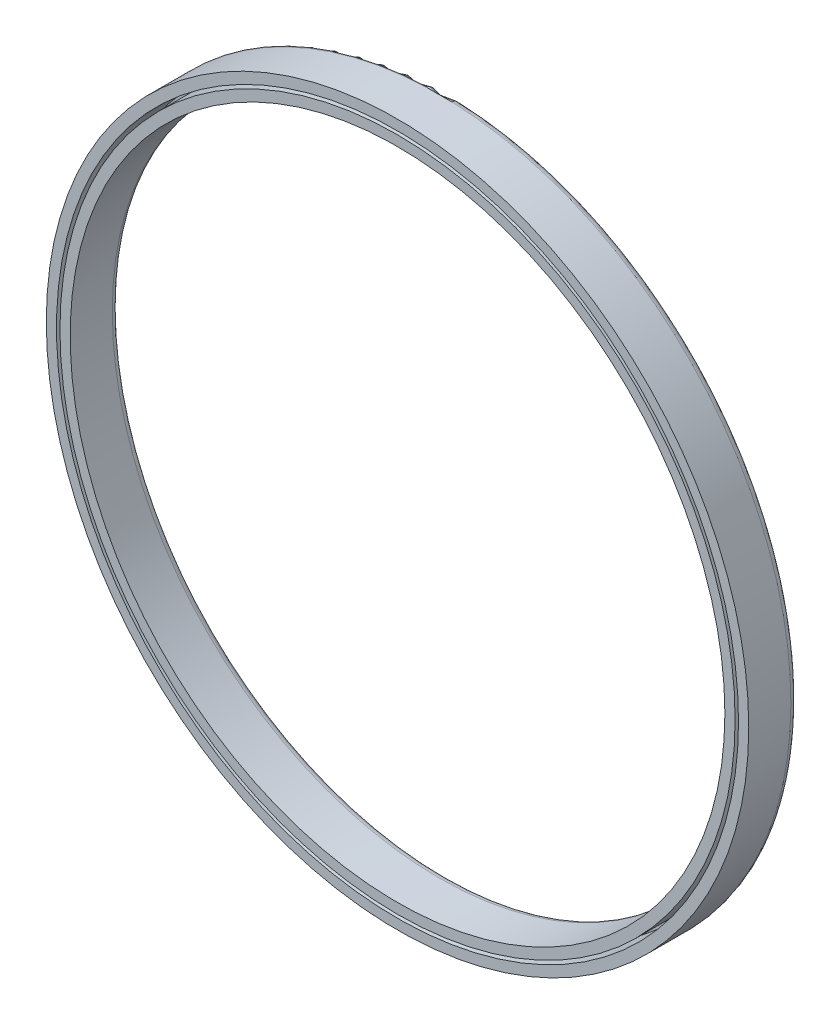
from build123d import *

# Parameters (mm, degrees)
FILLET2_R = 2
FILLET3_R = 2


with BuildPart() as part:
    # Sketch1 → Revolve1 (revolve)
    with BuildSketch(Plane(origin=(0, 0, 0), x_dir=(1, 0, 0), z_dir=(0, 1, 0)), mode=Mode.PRIVATE) as revolve1_sk:
        Polygon((-99, 0), (-99, 11.355578728), (-100, 11.355578728), (-100, 0), (-103, 0), (-103, 14.355578728), (-96, 14.355578728), (-96, 0), align=None)
    revolve(revolve1_sk.sketch.rotate(Axis((0, 0, 0), (0, 0, -1)), 180), axis=Axis((0, 0, 0), (0, 0, -1)))

    # Fillet2
    fillet2_edges = [part.edges().sort_by_distance(p)[0] for p in [
        (-103, 0, -14.355578728),
    ]]
    fillet(fillet2_edges, radius=FILLET2_R)

    # Fillet3
    fillet3_edges = [part.edges().sort_by_distance(p)[0] for p in [
        (-96, 0, -14.355578728),
    ]]
    fillet(fillet3_edges, radius=FILLET3_R)


solid = part.part
